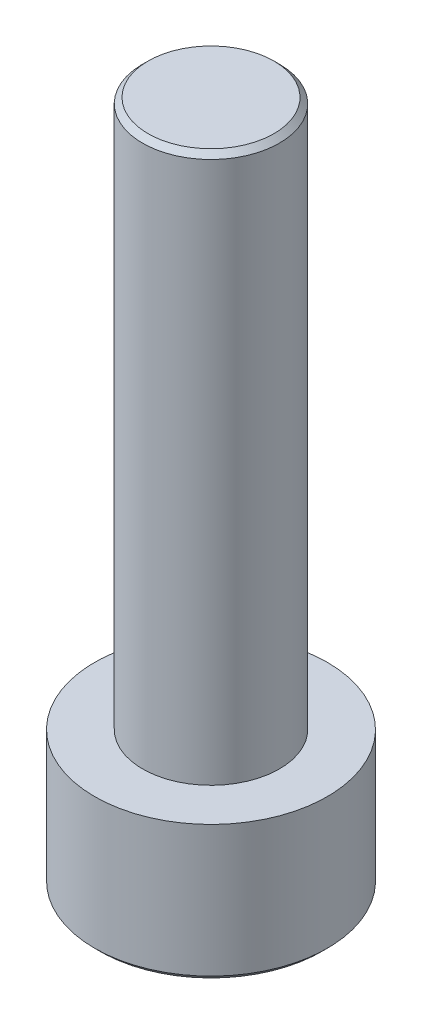
from build123d import *

# Parameters (mm, degrees)
SIMPLIFIED_START                    = -5
SIMPLIFIED_NOMINAL_HEX_SOCKET_DEPTH = 2.5


with BuildPart() as part:
    # Reconstructed nominal axial profile → Native revolved geometry (revolve)
    with BuildSketch(Plane.XY, mode=Mode.PRIVATE) as native_revolved_geometry_sk:
        Polygon((0, -5), (4.05, -5), (4.25, -4.8), (4.25, 0), (2.5, 0), (2.5, 19.8), (2.3, 20), (0, 20), align=None)
    revolve(native_revolved_geometry_sk.sketch.rotate(Axis((0, -500, 0), (0, 1, 0)), 90), axis=Axis((0, -500, 0), (0, 1, 0)))

    # Sketch2 → Simplified nominal hex socket (cut)
    with BuildSketch(Plane(origin=(0, 0, 0), x_dir=(1, 0, 0), z_dir=(0, 1, 0)).offset(SIMPLIFIED_START)):
        Polygon((2.309401077, 0), (1.154700538, -2), (-1.154700538, -2), (-2.309401077, 0), (-1.154700538, 2), (1.154700538, 2), align=None)
    extrude(amount=SIMPLIFIED_NOMINAL_HEX_SOCKET_DEPTH, mode=Mode.SUBTRACT)


solid = part.part
